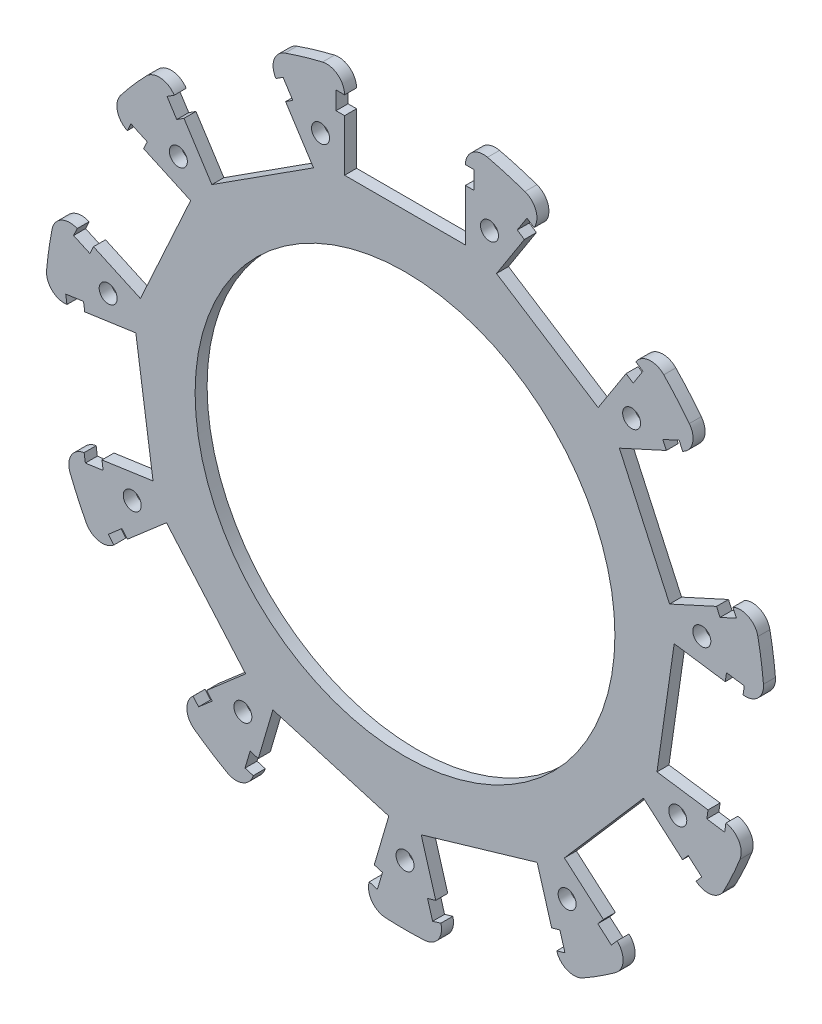
from build123d import *

# Parameters (mm, degrees)
BOSS_EXTRUDE1_DEPTH = 2
SKETCH2_R           = 35
CUT_EXTRUDE1_DEPTH  = 85.718414298
SKETCH4_R           = 1.5
CUT_EXTRUDE3_DEPTH  = 2
SKETCH5_W           = 23
SKETCH5_H           = 3
CUT_EXTRUDE4_DEPTH  = 85.718414298


with BuildPart() as part:
    # Sketch1 → Boss-Extrude1 (new body)
    with BuildSketch(Plane.XY):
        with BuildLine():
            Line((21.520746486, 52.119258472), (15.256667967, 42.372162038))
            Line((15.256667967, 42.372162038), (32.20522538, 31.479985569))
            Line((32.20522538, 31.479985569), (38.4693039, 41.227082003))
            ThreePointArc((38.4693039, 41.227082003), (40.698070229, 42.590620718), (43.150594208, 41.689641633))
            ThreePointArc((43.150594208, 41.689641633), (45.344974461, 39.291644037), (47.406271028, 36.778328771))
            ThreePointArc((47.406271028, 36.778328771), (47.949048893, 34.222545257), (46.282202516, 32.210516346))
            Line((46.282202516, 32.210516346), (35.742846148, 27.397353567))
            Line((35.742846148, 27.397353567), (44.112124759, 9.071189697))
            Line((44.112124759, 9.071189697), (54.651481127, 13.884352476))
            ThreePointArc((54.651481127, 13.884352476), (57.263623361, 13.826472187), (58.839711753, 11.742585779))
            ThreePointArc((58.839711753, 11.742585779), (59.389286513, 8.538890296), (59.764558712, 5.310133889))
            ThreePointArc((59.764558712, 5.310133889), (58.83941162, 2.86662411), (56.349386262, 2.075162869))
            Line((56.349386262, 2.075162869), (44.880923224, 3.724078919))
            Line((44.880923224, 3.724078919), (42.013736207, -16.217644809))
            Line((42.013736207, -16.217644809), (53.482199245, -17.86656086))
            ThreePointArc((53.482199245, -17.86656086), (55.648380681, -19.32748357), (55.847636558, -21.93265809))
            ThreePointArc((55.847636558, -21.93265809), (54.577919721, -24.92490078), (53.148021281, -27.843990983))
            ThreePointArc((53.148021281, -27.843990983), (51.048676897, -29.399429937), (48.526038015, -28.719040157))
            Line((48.526038015, -28.719040157), (39.76962429, -21.131564473))
            Line((39.76962429, -21.131564473), (26.576283265, -36.357491677))
            Line((26.576283265, -36.357491677), (35.33269699, -43.944967362))
            ThreePointArc((35.33269699, -43.944967362), (36.365170327, -46.345099856), (35.124331356, -48.644437984))
            ThreePointArc((35.124331356, -48.644437984), (32.438449047, -50.47521197), (29.657362619, -52.157845455))
            ThreePointArc((29.657362619, -52.157845455), (27.050347952, -52.331372705), (25.296015568, -50.395150852))
            Line((25.296015568, -50.395150852), (22.031750643, -39.278085453))
            Line((22.031750643, -39.278085453), (2.701048165, -44.954091828))
            Line((2.701048165, -44.954091828), (5.96531309, -56.071157227))
            ThreePointArc((5.96531309, -56.071157227), (5.536275339, -58.648474396), (3.249299125, -59.911952524))
            ThreePointArc((3.249299125, -59.911952524), (0, -60), (-3.249299125, -59.911952524))
            ThreePointArc((-3.249299125, -59.911952524), (-5.536275339, -58.648474396), (-5.96531309, -56.071157227))
            Line((-5.96531309, -56.071157227), (-2.701048165, -44.954091828))
            Line((-2.701048165, -44.954091828), (-22.031750643, -39.278085453))
            Line((-22.031750643, -39.278085453), (-25.296015568, -50.395150852))
            ThreePointArc((-25.296015568, -50.395150852), (-27.050347952, -52.331372705), (-29.657362619, -52.157845455))
            ThreePointArc((-29.657362619, -52.157845455), (-32.438449047, -50.47521197), (-35.124331356, -48.644437984))
            ThreePointArc((-35.124331356, -48.644437984), (-36.365170327, -46.345099856), (-35.33269699, -43.944967362))
            Line((-35.33269699, -43.944967362), (-26.576283265, -36.357491677))
            Line((-26.576283265, -36.357491677), (-39.76962429, -21.131564473))
            Line((-39.76962429, -21.131564473), (-48.526038015, -28.719040157))
            ThreePointArc((-48.526038015, -28.719040157), (-51.048676897, -29.399429937), (-53.148021281, -27.843990983))
            ThreePointArc((-53.148021281, -27.843990983), (-54.577919721, -24.92490078), (-55.847636558, -21.93265809))
            ThreePointArc((-55.847636558, -21.93265809), (-55.648380681, -19.32748357), (-53.482199245, -17.86656086))
            Line((-53.482199245, -17.86656086), (-42.013736207, -16.217644809))
            Line((-42.013736207, -16.217644809), (-44.880923224, 3.724078919))
            Line((-44.880923224, 3.724078919), (-56.349386262, 2.075162869))
            ThreePointArc((-56.349386262, 2.075162869), (-58.83941162, 2.86662411), (-59.764558712, 5.310133889))
            ThreePointArc((-59.764558712, 5.310133889), (-59.389286513, 8.538890296), (-58.839711753, 11.742585779))
            ThreePointArc((-58.839711753, 11.742585779), (-57.263623361, 13.826472187), (-54.651481127, 13.884352476))
            Line((-54.651481127, 13.884352476), (-44.112124759, 9.071189697))
            Line((-44.112124759, 9.071189697), (-35.742846148, 27.397353567))
            Line((-35.742846148, 27.397353567), (-46.282202516, 32.210516346))
            ThreePointArc((-46.282202516, 32.210516346), (-47.949048893, 34.222545257), (-47.406271028, 36.778328771))
            ThreePointArc((-47.406271028, 36.778328771), (-45.344974461, 39.291644037), (-43.150594208, 41.689641633))
            ThreePointArc((-43.150594208, 41.689641633), (-40.698070229, 42.590620718), (-38.4693039, 41.227082003))
            Line((-38.4693039, 41.227082003), (-32.20522538, 31.479985569))
            Line((-32.20522538, 31.479985569), (-15.256667967, 42.372162038))
            Line((-15.256667967, 42.372162038), (-21.520746486, 52.119258472))
            ThreePointArc((-21.520746486, 52.119258472), (-21.835201934, 54.713050089), (-19.99682725, 56.569664131))
            ThreePointArc((-19.99682725, 56.569664131), (-16.90395341, 57.569578417), (-13.76146789, 58.400530832))
            ThreePointArc((-13.76146789, 58.400530832), (-11.211167359, 57.832548102), (-10.073394495, 55.480504291))
            Line((-10.073394495, 55.480504291), (-10.073394495, 43.894108449))
            Line((-10.073394495, 43.894108449), (10.073394495, 43.894108449))
            Line((10.073394495, 43.894108449), (10.073394495, 55.480504291))
            ThreePointArc((10.073394495, 55.480504291), (11.211167359, 57.832548102), (13.76146789, 58.400530832))
            ThreePointArc((13.76146789, 58.400530832), (16.90395341, 57.569578417), (19.99682725, 56.569664131))
            ThreePointArc((19.99682725, 56.569664131), (21.835201934, 54.713050089), (21.520746486, 52.119258472))
        make_face()
    extrude(amount=BOSS_EXTRUDE1_DEPTH)

    # Sketch2 → Cut-Extrude1 (cut, through all)
    with BuildSketch(Plane.XY.offset(2)):
        Circle(SKETCH2_R)
    extrude(amount=-CUT_EXTRUDE1_DEPTH, mode=Mode.SUBTRACT)

    # Sketch4 → Cut-Extrude3 (cut)
    with BuildSketch(Plane.XY.offset(2)):
        with Locations((-14.086627842, 47.974648681)):
            Circle(SKETCH4_R)
        with Locations((14.086627842, 47.974648681)):
            Circle(SKETCH4_R)
        with Locations((37.787478718, 32.743036697)):
            Circle(SKETCH4_R)
        with Locations((49.491072094, 7.115741914)):
            Circle(SKETCH4_R)
        with Locations((45.481599768, -20.77075065)):
            Circle(SKETCH4_R)
        with Locations((27.032040873, -42.062676642)):
            Circle(SKETCH4_R)
        with Locations((0, -50)):
            Circle(SKETCH4_R)
        with Locations((-27.032040873, -42.062676642)):
            Circle(SKETCH4_R)
        with Locations((-45.481599768, -20.77075065)):
            Circle(SKETCH4_R)
        with Locations((-49.491072094, 7.115741914)):
            Circle(SKETCH4_R)
        with Locations((-37.787478718, 32.743036697)):
            Circle(SKETCH4_R)
    extrude(amount=-CUT_EXTRUDE3_DEPTH, mode=Mode.SUBTRACT)

    # Sketch5 → Cut-Extrude4 (cut, through all)
    with BuildSketch(Plane.XY.offset(2)):
        Polygon((20.331149741, 52.906940473), (18.709227289, 50.383179874), (38.058058544, 37.948441073), (39.679980996, 40.472201671), align=None)
        with Locations((0, 54)):
            Rectangle(SKETCH5_W, SKETCH5_H)
        Polygon((45.707303093, 33.516301168), (42.978407107, 32.270056129), (52.532952406, 11.348520236), (55.261848392, 12.594765275), align=None)
        Polygon((56.571710665, 3.484473057), (53.602246339, 3.911417572), (50.329005059, -18.854475591), (53.298469384, -19.281420106), align=None)
        Polygon((49.474999817, -27.653650629), (47.207751094, -25.689068427), (32.145954213, -43.071308637), (34.413202936, -45.035890839), align=None)
        Polygon((26.670326101, -50.011935632), (25.825128431, -47.133456711), (3.756790038, -53.613305518), (4.601987708, -56.491784439), align=None)
        Polygon((-4.601987708, -56.491784439), (-3.756790038, -53.613305518), (-25.825128431, -47.133456711), (-26.670326101, -50.011935632), align=None)
        Polygon((-34.413202936, -45.035890839), (-32.145954213, -43.071308637), (-47.207751094, -25.689068427), (-49.474999817, -27.653650629), align=None)
        Polygon((-53.298469384, -19.281420106), (-50.329005059, -18.854475591), (-53.602246339, 3.911417572), (-56.571710665, 3.484473057), align=None)
        Polygon((-55.261848392, 12.594765275), (-52.532952406, 11.348520236), (-42.978407107, 32.270056129), (-45.707303093, 33.516301168), align=None)
        Polygon((-39.679980996, 40.472201671), (-38.058058544, 37.948441073), (-18.709227289, 50.383179874), (-20.331149741, 52.906940473), align=None)
    extrude(amount=-CUT_EXTRUDE4_DEPTH, mode=Mode.SUBTRACT)


solid = part.part
